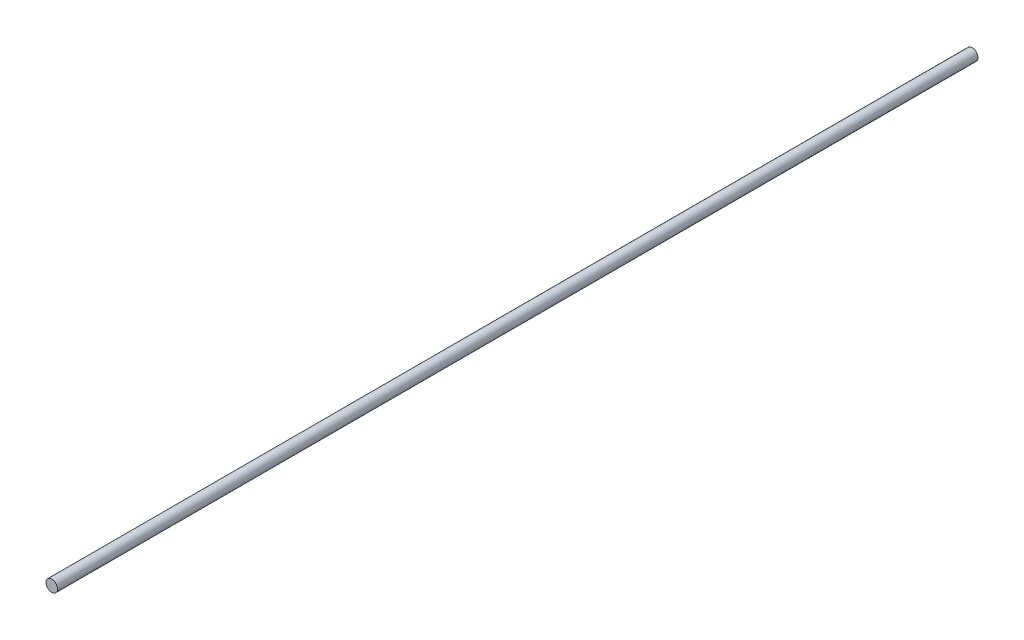
from build123d import *

# Parameters (mm, degrees)
ESQUISSE1_R        = 5
BOSS_EXTRU_1_DEPTH = 800


with BuildPart() as part:
    # Esquisse1 → Boss.-Extru.1 (new body)
    with BuildSketch(Plane.XY):
        Circle(ESQUISSE1_R)
    extrude(amount=BOSS_EXTRU_1_DEPTH)


solid = part.part
